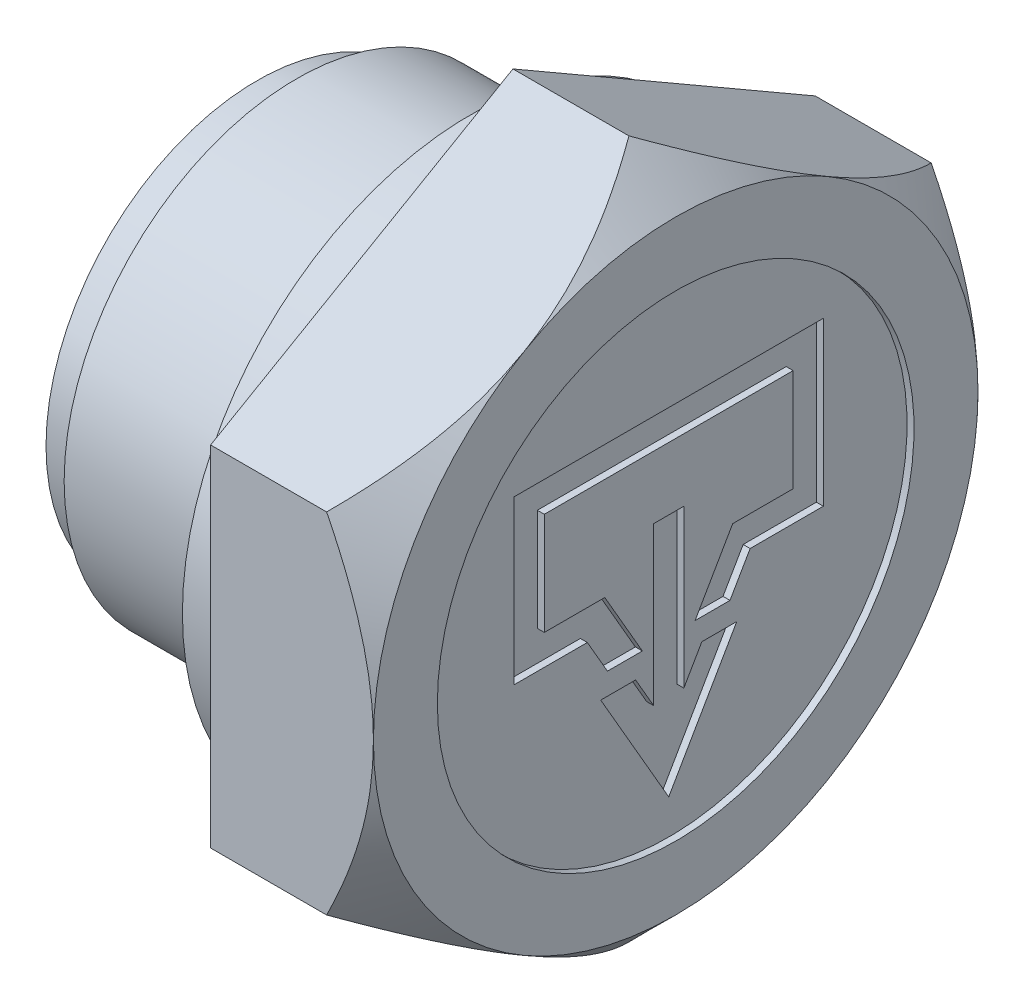
from build123d import *

# Parameters (mm, degrees)
TAGLIO_ESTRUSIONE1_DEPTH      = 0.3
TAGLIO_ESTRUSIONE1_DEPTH_BACK = 0.3
TAGLIO_ESTRUSIONE2_DEPTH      = 0.3
TAGLIO_ESTRUSIONE2_DEPTH_BACK = 0.3
TAGLIO_ESTRUSIONE3_DEPTH      = 10.701
TAGLIO_ESTRUSIONE3_DEPTH_BACK = 10.701


with BuildPart() as part:
    # Schizzo1 → Rivoluzione1 (revolve)
    with BuildSketch(Plane.XY):
        with BuildLine():
            Line((14.2, 0), (14.2, 5.687947352))
            ThreePointArc((14.2, 5.687947352), (14.0596699, 6.035276538), (13.717449748, 6.187642766))
            Line((13.717449748, 6.187642766), (0, 6.666666667))
            Line((0, 6.666666667), (0, 9.0798475))
            Line((0, 9.0798475), (1.7, 9.0798475))
            Line((1.7, 9.0798475), (1.7, 10))
            Line((1.7, 10), (9.166666667, 10))
            Line((9.166666667, 10), (9.166666667, 12.380952381))
            Line((9.166666667, 12.380952381), (11, 12.380952381))
            Line((11, 12.380952381), (11, 20))
            Line((11, 20), (18, 13))
            Line((18, 13), (18, 10.25))
            Line((18, 10.25), (17.7, 10.25))
            Line((17.7, 10.25), (17.7, 0))
            Line((17.7, 0), (14.2, 0))
        make_face()
    revolve(axis=Axis((18, 0, 0), (-1, 0, 0)))

    # Schizzo2 → Taglio-Estrusione1 (cut, two sides: drawn at the far end of the back side and taken through both)
    with BuildSketch(Plane(origin=(17.7, 0, 0), x_dir=(0, 0, -1), z_dir=(1, 0, 0)).offset(-TAGLIO_ESTRUSIONE1_DEPTH_BACK)):
        Polygon((-6.65, 5.75), (-6.65, -1.25), (-3.50055, -1.25), (-2.63453, -2.75), (-1.13342, -2.75), (-2.75, 0.05), (-5.35, 0.05), (-5.35, 4.45), (5.35, 4.45), (5.35, 0.05), (2.75, 0.05), (1.13342, -2.75), (2.63453, -2.75), (3.50055, -1.25), (6.65, -1.25), (6.65, 5.75), align=None)
    extrude(amount=TAGLIO_ESTRUSIONE1_DEPTH + TAGLIO_ESTRUSIONE1_DEPTH_BACK, mode=Mode.SUBTRACT)

    # Schizzo3 → Taglio-Estrusione2 (cut, two sides: drawn at the far end of the back side and taken through both)
    with BuildSketch(Plane(origin=(17.7, 0, 0), x_dir=(0, 0, -1), z_dir=(1, 0, 0)).offset(-TAGLIO_ESTRUSIONE2_DEPTH_BACK)):
        Polygon((-2.925, -3.68375), (0, -8.75), (2.925, -3.68375), (1.42389, -3.68375), (0.65, -5.02417), (0.65, 1.75), (-0.65, 1.75), (-0.65, -5.02417), (-1.42389, -3.68375), align=None)
    extrude(amount=TAGLIO_ESTRUSIONE2_DEPTH + TAGLIO_ESTRUSIONE2_DEPTH_BACK, mode=Mode.SUBTRACT)

    # Schizzo4 → Taglio-Estrusione3 (cut, two sides: drawn at the far end of the back side and taken through both)
    with BuildSketch(Plane(origin=(17.7, 0, 0), x_dir=(0, 0, -1), z_dir=(1, 0, 0)).offset(-TAGLIO_ESTRUSIONE3_DEPTH_BACK)):
        Polygon((-26, -15.011106999), (0, -30.022213998), (26, -15.011106999), (26, 15.011106999), (0, 30.022213998), (-26, 15.011106999), align=None)
        Polygon((-13, -7.505553499), (0, -15.011106999), (13, -7.505553499), (13, 7.505553499), (0, 15.011106999), (-13, 7.505553499), align=None, mode=Mode.SUBTRACT)
    extrude(amount=TAGLIO_ESTRUSIONE3_DEPTH + TAGLIO_ESTRUSIONE3_DEPTH_BACK, mode=Mode.SUBTRACT)


solid = part.part
